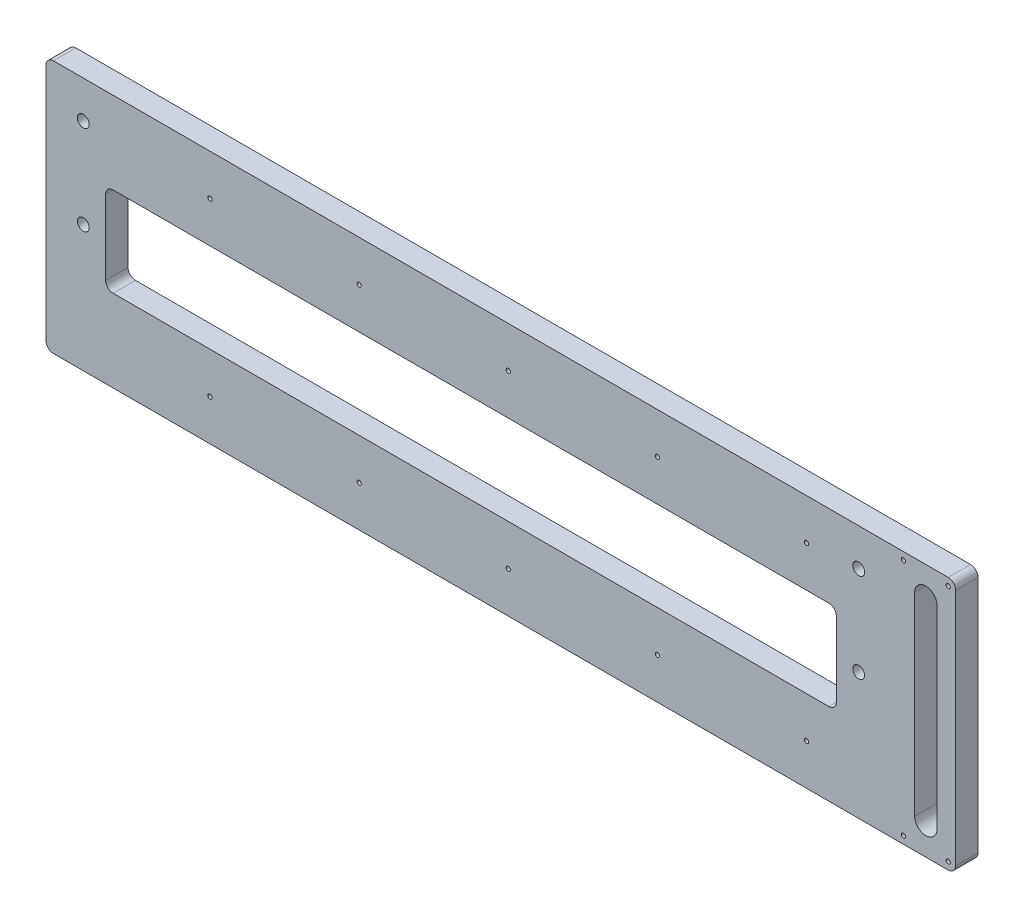
from build123d import *

# Parameters (mm, degrees)
SKETCH2_W                   = 723.9
SKETCH2_H                   = 215.9
BOSS_EXTRUDE1_DEPTH         = 19.05
CUT_EXTRUDE3_DEPTH          = 409.675659906
F_27_0_144_DIAMETER_HOLE1_D = 3.6576
F_3_8_CLEARANCE_HOLE1_D     = 10.0838
SKETCH22_W                  = 19.05
SKETCH22_H                  = 215.9
BOSS_EXTRUDE2_DEPTH         = 50.8
FILLET1_R                   = 6.35
F_6_CLEARANCE_HOLE1_D       = 3.6576
CUT_EXTRUDE4_DEPTH          = 76.2


with BuildPart() as part:
    # Sketch2 → Boss-Extrude1 (new body)
    with BuildSketch(Plane.XY):
        with Locations((-31.75, 0)):
            Rectangle(SKETCH2_W, SKETCH2_H)
    extrude(amount=BOSS_EXTRUDE1_DEPTH)

    # Sketch13 → Cut-Extrude3 (cut, through all)
    with BuildSketch(Plane.XY.offset(19.05)):
        with BuildLine():
            Line((-336.55, -38.1), (273.05, -38.1))
            ThreePointArc((273.05, -38.1), (277.540128061, -36.240128061), (279.4, -31.75))
            Line((279.4, -31.75), (279.4, 31.75))
            ThreePointArc((279.4, 31.75), (277.540128061, 36.240128061), (273.05, 38.1))
            Line((273.05, 38.1), (-336.55, 38.1))
            ThreePointArc((-336.55, 38.1), (-341.040128061, 36.240128061), (-342.9, 31.75))
            Line((-342.9, 31.75), (-342.9, -31.75))
            ThreePointArc((-342.9, -31.75), (-341.040128061, -36.240128061), (-336.55, -38.1))
        make_face()
    extrude(amount=-CUT_EXTRUDE3_DEPTH, mode=Mode.SUBTRACT)

    # #27 (0.144) Diameter Hole1 (through all)
    with Locations(Plane(origin=(0, 0, 0), x_dir=(-1, 0, 0), z_dir=(0, 0, -1))):
        with Locations((0, 0), (-254, 73.025), (-127, 73.025), (0, 73.025), (127, 73.025), (254, 73.025), (-127, -73.025), (0, -73.025), (127, -73.025), (254, -73.025), (-254, -73.025)):
            Hole(F_27_0_144_DIAMETER_HOLE1_D / 2)

    # 3/8 Clearance Hole1 (through all)
    with Locations(Plane(origin=(0, 0, 0), x_dir=(-1, 0, 0), z_dir=(0, 0, -1))):
        with Locations((-298.45, 76.2), (361.95, 76.2), (361.95, 0), (-298.45, 0)):
            Hole(F_3_8_CLEARANCE_HOLE1_D / 2)

    # Sketch22 → Boss-Extrude2 (add)
    with BuildSketch(Plane(origin=(330.2, 0, 0), x_dir=(0, 0, -1), z_dir=(1, 0, 0))):
        with Locations((-9.525, 0)):
            Rectangle(SKETCH22_W, SKETCH22_H)
    extrude(amount=BOSS_EXTRUDE2_DEPTH)

    # Fillet1
    fillet1_edges = [part.edges().sort_by_distance(p)[0] for p in [
        (381, -107.95, 9.525),
        (381, 107.95, 9.525),
        (-393.7, 107.95, 9.525),
        (-393.7, -107.95, 9.525),
    ]]
    fillet(fillet1_edges, radius=FILLET1_R)

    # #6 Clearance Hole1 (through all)
    with Locations(Plane.XY.offset(19.05)):
        with Locations((336.55, -101.6), (355.6, 0), (336.55, 101.6), (374.65, -101.6), (374.65, 101.6)):
            Hole(F_6_CLEARANCE_HOLE1_D / 2)

    # Sketch25 → Cut-Extrude4 (cut)
    with BuildSketch(Plane.XY.offset(19.05)):
        with BuildLine():
            Line((346.075, -82.55), (346.075, 82.55))
            ThreePointArc((346.075, 82.55), (355.6, 92.075), (365.125, 82.55))
            Line((365.125, 82.55), (365.125, -82.55))
            ThreePointArc((365.125, -82.55), (355.6, -92.075), (346.075, -82.55))
        make_face()
    extrude(amount=-CUT_EXTRUDE4_DEPTH, mode=Mode.SUBTRACT)


solid = part.part
